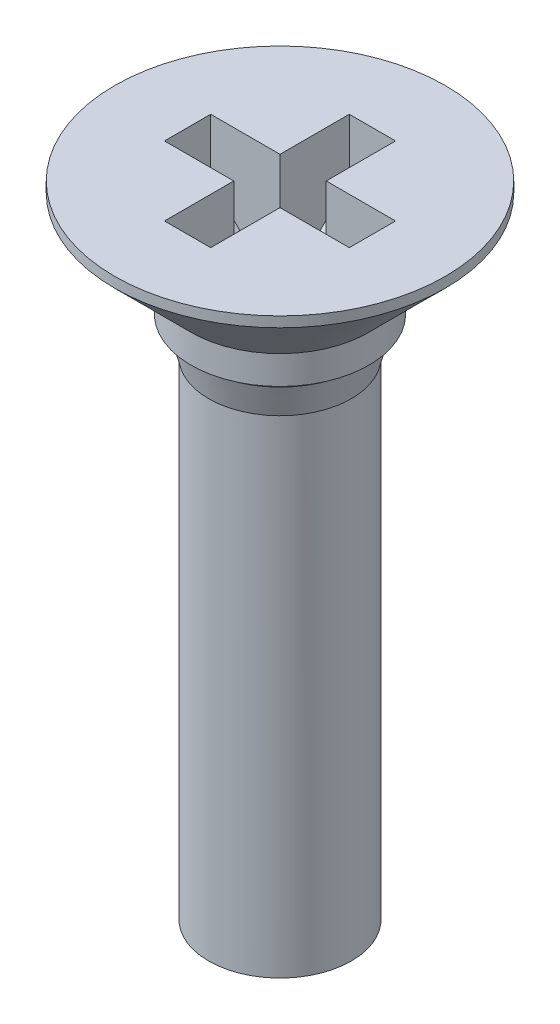
from build123d import *

# Parameters (mm, degrees)
KREUZSCHLITZ1_H_DEPTH      = 0.65
KREUZSCHLITZ1_H_DEPTH_BACK = 0.65
KREUZSCHLITZ2_H_DEPTH      = 0.65
KREUZSCHLITZ2_H_DEPTH_BACK = 0.65
BOSS_EXTRUDE1_START        = 2
SKETCH1_R                  = 2.0095
BOSS_EXTRUDE1_DEPTH        = 2


with BuildPart() as part:
    # Skizze1 → Basis-Rotation (revolve)
    with BuildSketch(Plane.XY, mode=Mode.PRIVATE) as basis_rotation_sk:
        Polygon((0, 0), (4.65, 0), (4.65, -0.29), (2.5, -2.44), (2.5, -3.24), (2.24, -3.24), (2.24, -3.439762289), (2.0095, -4.3), (2.0095, -16), (0, -16), align=None)
    revolve(basis_rotation_sk.sketch.rotate(Axis((0, 0, 0), (0, -1, 0)), 180), axis=Axis((0, 0, 0), (0, -1, 0)))

    # Skizze2 → Kreuzschlitz1 H (cut, two sides: drawn at the far end of the back side and taken through both)
    with BuildSketch(Plane.XY.offset(-KREUZSCHLITZ1_H_DEPTH_BACK)):
        Polygon((-1, -3.2), (1, -3.2), (2.6, -1.6), (2.6, 0), (-2.6, 0), (-2.6, -1.6), align=None)
    extrude(amount=KREUZSCHLITZ1_H_DEPTH + KREUZSCHLITZ1_H_DEPTH_BACK, mode=Mode.SUBTRACT)

    # Skizze3 → Kreuzschlitz2 H (cut, two sides: drawn at the far end of the back side and taken through both)
    with BuildSketch(Plane(origin=(0, 0, 0), x_dir=(0, 0, -1), z_dir=(1, 0, 0)).offset(-KREUZSCHLITZ2_H_DEPTH_BACK)):
        Polygon((-1, -3.2), (1, -3.2), (2.6, -1.6), (2.6, 0), (-2.6, 0), (-2.6, -1.6), align=None)
    extrude(amount=KREUZSCHLITZ2_H_DEPTH + KREUZSCHLITZ2_H_DEPTH_BACK, mode=Mode.SUBTRACT)

    # Sketch1 → Boss-Extrude1 (add)
    with BuildSketch(Plane.XZ.offset(16).offset(BOSS_EXTRUDE1_START)):
        with Locations(Location((0, 0, 0), (0, 0, 180))):
            Circle(SKETCH1_R)
    extrude(amount=-BOSS_EXTRUDE1_DEPTH)


solid = part.part
